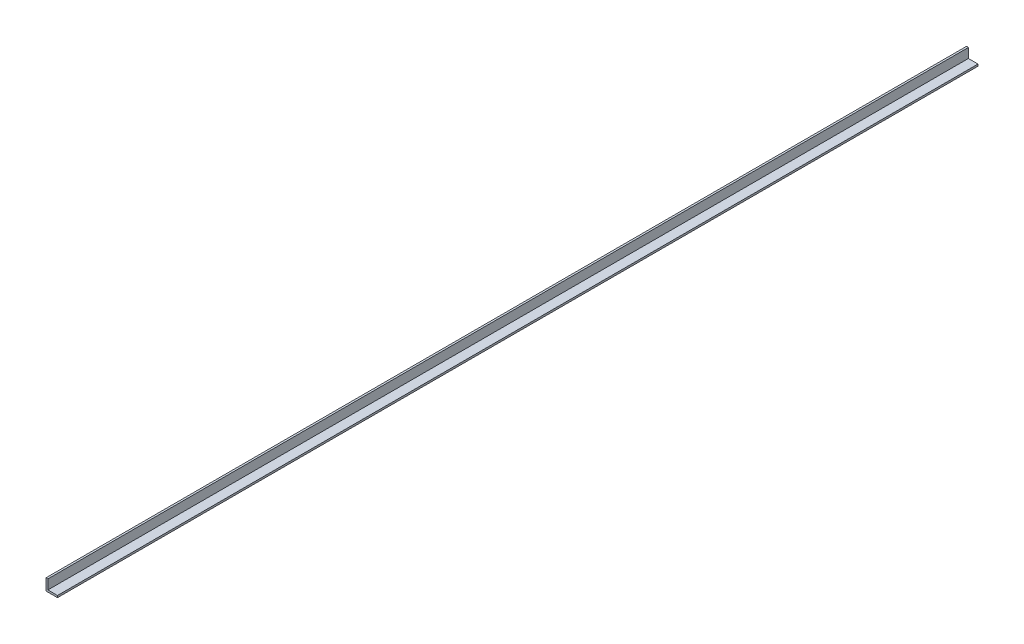
from build123d import *

# Parameters (mm, degrees)
SALIENTE_EXTRUIR1_DEPTH = 6100


with BuildPart() as part:
    # Croquis1 → Saliente-Extruir1 (new body)
    with BuildSketch(Plane.XY):
        Polygon((0, 76.2), (0, 0), (76.2, 0), (76.2, 12.7), (12.7, 12.7), (12.7, 76.2), align=None)
    extrude(amount=-SALIENTE_EXTRUIR1_DEPTH)


solid = part.part
